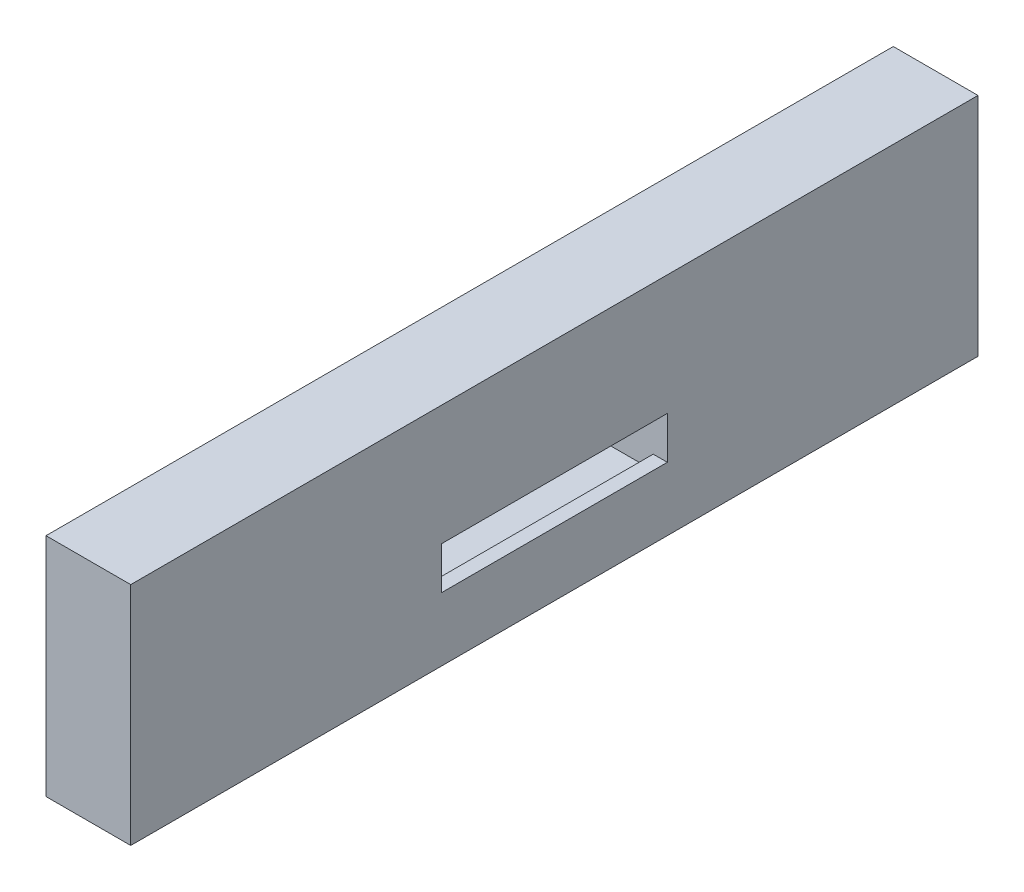
from build123d import *

# Parameters (mm, degrees)
SKETCH1_W           = 762
SKETCH1_H           = 203.2
BOSS_EXTRUDE1_DEPTH = 76.2
SKETCH2_W           = 203.2
SKETCH2_H           = 95.25
CUT_EXTRUDE1_DEPTH  = 63.5
SKETCH3_W           = 203.2
SKETCH3_H           = 38.1
CUT_EXTRUDE2_DEPTH  = 792.18044086
FILLET1_R           = 25.4


with BuildPart() as part:
    # Sketch1 → Boss-Extrude1 (new body)
    with BuildSketch(Plane(origin=(0, 0, 0), x_dir=(0, 0, -1), z_dir=(1, 0, 0))):
        with Locations((381, 101.6)):
            Rectangle(SKETCH1_W, SKETCH1_H)
    extrude(amount=BOSS_EXTRUDE1_DEPTH)

    # Sketch2 → Cut-Extrude1 (cut)
    with BuildSketch(Plane.ZY):
        with Locations((-381, 92.075)):
            Rectangle(SKETCH2_W, SKETCH2_H)
    extrude(amount=-CUT_EXTRUDE1_DEPTH, mode=Mode.SUBTRACT)

    # Sketch3 → Cut-Extrude2 (cut, through all)
    with BuildSketch(Plane.ZY.offset(-63.5)):
        with Locations((-381, 76.2)):
            Rectangle(SKETCH3_W, SKETCH3_H)
    extrude(amount=-CUT_EXTRUDE2_DEPTH, mode=Mode.SUBTRACT)

    # Fillet1
    fillet1_edges = [part.edges().sort_by_distance(p)[0] for p in [
        (31.75, 139.7, -482.6),
        (31.75, 139.7, -279.4),
    ]]
    fillet(fillet1_edges, radius=FILLET1_R)


solid = part.part
